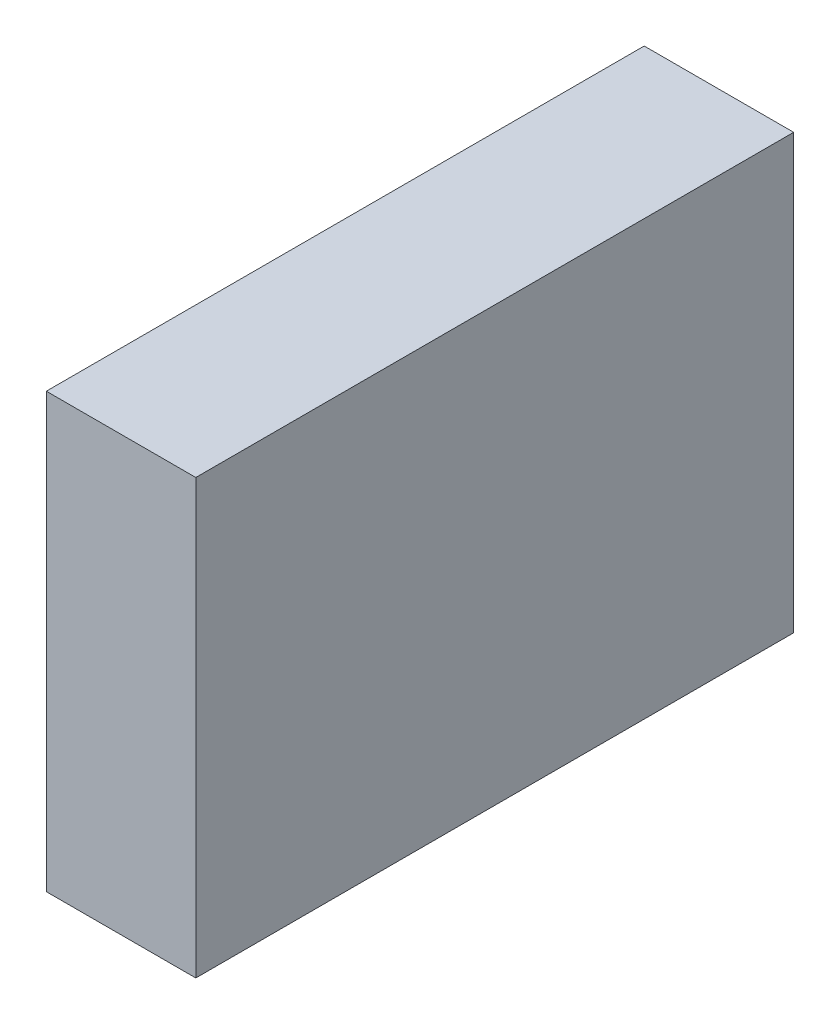
from build123d import *

# Parameters (mm, degrees)
SKETCH1_W           = 40
SKETCH1_H           = 29
BOSS_EXTRUDE1_DEPTH = 10


with BuildPart() as part:
    # Sketch1 → Boss-Extrude1 (new body)
    with BuildSketch(Plane(origin=(0, 0, 0), x_dir=(0, 0, -1), z_dir=(1, 0, 0))):
        with Locations((20, 14.5)):
            Rectangle(SKETCH1_W, SKETCH1_H)
    extrude(amount=-BOSS_EXTRUDE1_DEPTH)


solid = part.part
